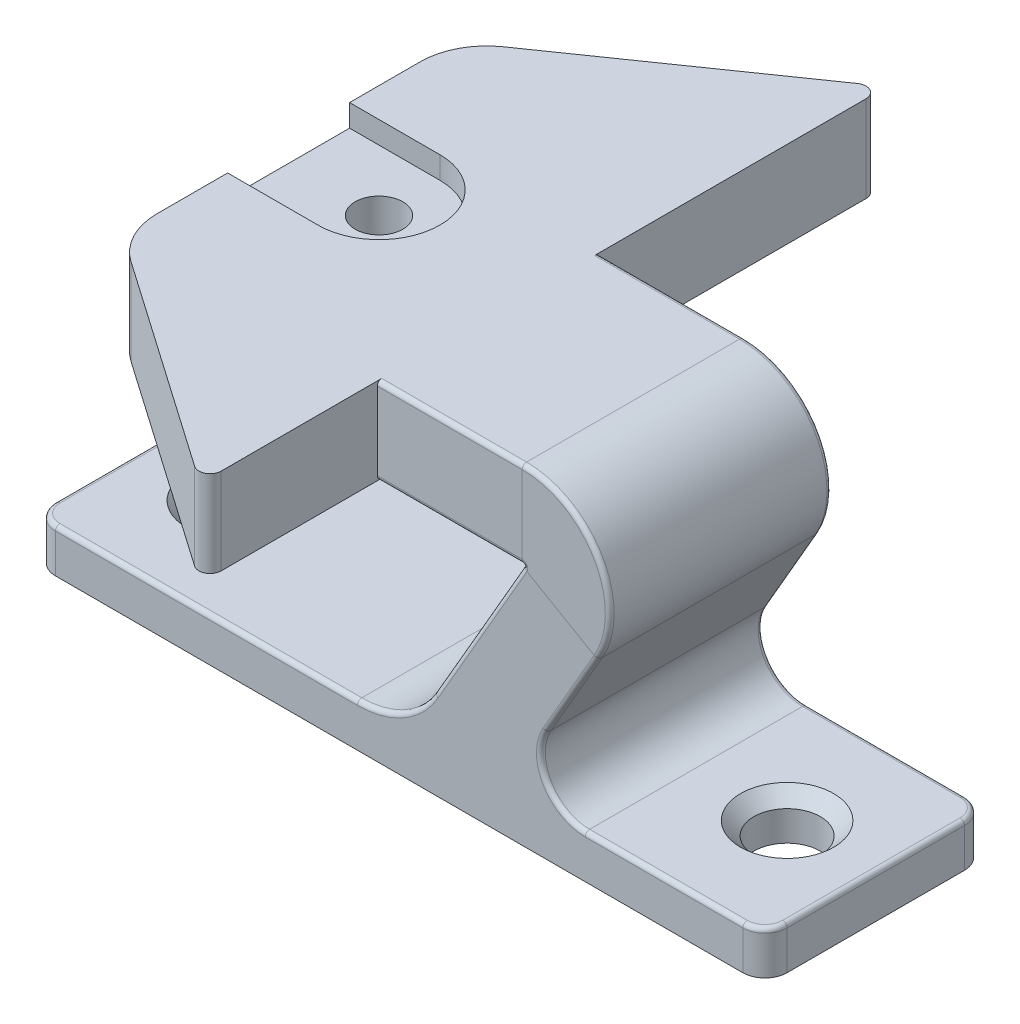
from build123d import *

# Parameters (mm, degrees)
SKETCH1_R           = 1.075
BOSS_EXTRUDE1_DEPTH = 3.9
CUT_EXTRUDE1_DEPTH  = 1
CUT_EXTRUDE2_START  = -1
SKETCH4_R           = 2.75
SKETCH4_R_2         = 1.075
CUT_EXTRUDE2_DEPTH  = 1
SKETCH6_W           = 10
SKETCH6_H           = 3.9
BOSS_EXTRUDE2_DEPTH = 5
SKETCH7_W           = 10
SKETCH7_H           = 3.9
BOSS_EXTRUDE3_DEPTH = 10
SKETCH10_R          = 1.5
CUT_EXTRUDE3_DEPTH  = 10
FILLET2_R           = 3
FILLET3_R           = 1
FILLET4_R           = 2
FILLET5_R           = 4
CHAMFER1_SIZE       = 0.6
FILLET6_R           = 0.5
FILLET7_R           = 0.2


with BuildPart() as part:
    # Sketch1 → Boss-Extrude1 (new body)
    with BuildSketch(Plane(origin=(0, 0, 0), x_dir=(1, 0, 0), z_dir=(0, 1, 0))):
        Polygon((-4.075, 0), (-4.075, 7.5), (7.425, 15.5), (7.425, -15.5), (-4.075, -7.5), align=None)
        with Locations(Location((0, 0, 0), (0, 0, 270))):
            Circle(SKETCH1_R, mode=Mode.SUBTRACT)
    extrude(amount=BOSS_EXTRUDE1_DEPTH)

    # Sketch2 → Cut-Extrude1 (cut)
    with BuildSketch(Plane.XZ):
        with BuildLine():
            ThreePointArc((-4.075, 0), (-2.683757211, 3.358757211), (0.675, 4.75))
            Line((0.675, 4.75), (-4.075, 4.75))
            Line((-4.075, 4.75), (-4.075, 0))
        make_face()
        with BuildLine():
            Line((-4.075, -4.75), (0.675, -4.75))
            ThreePointArc((0.675, -4.75), (-2.683757211, -3.358757211), (-4.075, 0))
            Line((-4.075, 0), (-4.075, -4.75))
        make_face()
        with BuildLine():
            ThreePointArc((-1.075, 0), (0, 1.075), (1.075, 0))
            Line((1.075, 0), (5.425, 0))
            ThreePointArc((5.425, 0), (4.033757211, 3.358757211), (0.675, 4.75))
            ThreePointArc((0.675, 4.75), (-2.683757211, 3.358757211), (-4.075, 0))
            Line((-4.075, 0), (-1.075, 0))
        make_face()
        with BuildLine():
            Line((5.425, 0), (1.075, 0))
            ThreePointArc((1.075, 0), (0, -1.075), (-1.075, 0))
            Line((-1.075, 0), (-4.075, 0))
            ThreePointArc((-4.075, 0), (-2.683757211, -3.358757211), (0.675, -4.75))
            ThreePointArc((0.675, -4.75), (4.033757211, -3.358757211), (5.425, 0))
        make_face()
    extrude(amount=-CUT_EXTRUDE1_DEPTH, mode=Mode.SUBTRACT)

    # Sketch4 → Cut-Extrude2 (cut)
    # profile 1 of 2: a face of its own
    with BuildSketch(Plane(origin=(0, 3.9, 0), x_dir=(1, 0, 0), z_dir=(0, 1, 0)).offset(CUT_EXTRUDE2_START)):
        with BuildLine():
            ThreePointArc((0, -2.75), (-2.75, 0), (0, 2.75))
            Line((0, 2.75), (-4.075, 2.75))
            Line((-4.075, 2.75), (-4.075, -2.75))
            Line((-4.075, -2.75), (0, -2.75))
        make_face()
    # profile 2 of 2: a face of its own
    with BuildSketch(Plane(origin=(0, 3.9, 0), x_dir=(1, 0, 0), z_dir=(0, 1, 0)).offset(CUT_EXTRUDE2_START)):
        Circle(SKETCH4_R)
        with Locations(Location((0, 0, 0), (0, 0, 90))):
            Circle(SKETCH4_R_2, mode=Mode.SUBTRACT)
    extrude(amount=CUT_EXTRUDE2_DEPTH, mode=Mode.SUBTRACT)

    # Sketch6 → Boss-Extrude2 (add)
    with BuildSketch(Plane(origin=(7.425, 0, 0), x_dir=(0, 0, -1), z_dir=(1, 0, 0))):
        with Locations((-2.5, 1.95)):
            Rectangle(SKETCH6_W, SKETCH6_H)
    extrude(amount=BOSS_EXTRUDE2_DEPTH)

    # Sweep1: sweep along a path in Sketch8
    with BuildLine(Plane.XY) as sweep1_path:
        Line((12.425, 1.95), (13.960898385, 1.95))
        ThreePointArc((13.960898385, 1.95), (15.692949192, 0.95), (15.692949192, -1.05))
        Line((15.692949192, -1.05), (10.525664283, -10))
    # Sketch7 → Sweep1 (sweep)
    with BuildSketch(Plane(origin=(12.425, 0, 0), x_dir=(0, 0, -1), z_dir=(1, 0, 0))):
        with Locations((-2.5, 1.95)):
            Rectangle(SKETCH7_W, SKETCH7_H)
    sweep(path=sweep1_path.line)

    # Sketch9 → Boss-Extrude3 (add)
    with BuildSketch(Plane(origin=(0, 0, -2.5), x_dir=(-1, 0, 0), z_dir=(0, 0, -1))):
        Polygon((-12.214413821, -10.975), (8.089101615, -10.975), (8.089101615, -9.025), (-24.910898385, -9.025), (-24.910898385, -10.975), align=None)
    extrude(amount=-BOSS_EXTRUDE3_DEPTH)

    # Sketch10 → Cut-Extrude3 (cut)
    with BuildSketch(Plane.XZ.offset(10.975)):
        with Locations(Location((-4.089101615, 2.5, 0), (0, 0, 270))):
            Circle(SKETCH10_R)
        with Locations(Location((20.910898385, 2.5, 0), (0, 0, 270))):
            Circle(SKETCH10_R)
    extrude(amount=-CUT_EXTRUDE3_DEPTH, mode=Mode.SUBTRACT)

    # Fillet2
    fillet2_edges = [part.edges().sort_by_distance(p)[0] for p in [
        (-4.075, 1.95, -7.5),
        (-4.075, 1.95, 7.5),
    ]]
    fillet(fillet2_edges, radius=FILLET2_R)

    # Fillet3
    fillet3_edges = [part.edges().sort_by_distance(p)[0] for p in [
        (-8.089101615, -10, -2.5),
        (24.910898385, -10, 7.5),
        (-8.089101615, -10, 7.5),
        (24.910898385, -10, -2.5),
    ]]
    fillet(fillet3_edges, radius=FILLET3_R)

    # Fillet4
    fillet4_edges = [part.edges().sort_by_distance(p)[0] for p in [
        (13.340246845, -9.025, 2.5),
    ]]
    fillet(fillet4_edges, radius=FILLET4_R)

    # Fillet5
    fillet5_edges = [part.edges().sort_by_distance(p)[0] for p in [
        (8.836914746, -9.025, 2.5),
    ]]
    fillet(fillet5_edges, radius=FILLET5_R)

    # Chamfer1
    chamfer1_edges = [part.edges().sort_by_distance(p)[0] for p in [
        (-4.089101615, -9.025, 4),
        (20.910898385, -9.025, 4),
    ]]
    chamfer(chamfer1_edges, length=CHAMFER1_SIZE)

    # Fillet6
    fillet6_edges = [part.edges().sort_by_distance(p)[0] for p in [
        (7.425, 1.95, -15.5),
        (7.425, 1.95, 15.5),
    ]]
    fillet(fillet6_edges, radius=FILLET6_R)

    # Fillet7
    fillet7_edges = [part.edges().sort_by_distance(p)[0] for p in [
        (24.910898385, -9.025, 2.5),
        (-0.280793973, -9.025, 7.5),
        (24.618005166, -9.025, -2.207106781),
        (24.618005166, -9.025, 7.207106781),
        (-0.280793973, -9.025, -2.5),
        (-8.089101615, -9.025, 2.5),
        (-7.796208396, -9.025, 7.207106781),
        (-7.796208396, -9.025, -2.207106781),
        (20.357623423, -9.025, 7.5),
        (20.357623423, -9.025, -2.5),
        (15.072297653, -8.025, 7.5),
        (15.072297653, -8.025, -2.5),
        (8.527513669, -8.489101615, -2.5),
        (8.527513669, -8.489101615, 7.5),
        (10.692949192, 3.9, 7.5),
        (10.692949192, 0, 7.5),
        (10.692949192, 0, -2.5),
        (10.692949192, 3.9, -2.5),
        (17.38169873, 1.925, 7.5),
        (14.004199655, -0.025, 7.5),
        (14.004199655, -0.025, -2.5),
        (17.38169873, 1.925, -2.5),
        (16.226998191, -4.025, 7.5),
        (11.99790747, -3.55, 7.5),
        (11.99790747, -3.55, -2.5),
        (16.226998191, -4.025, -2.5),
    ]]
    fillet(fillet7_edges, radius=FILLET7_R)


solid = part.part
